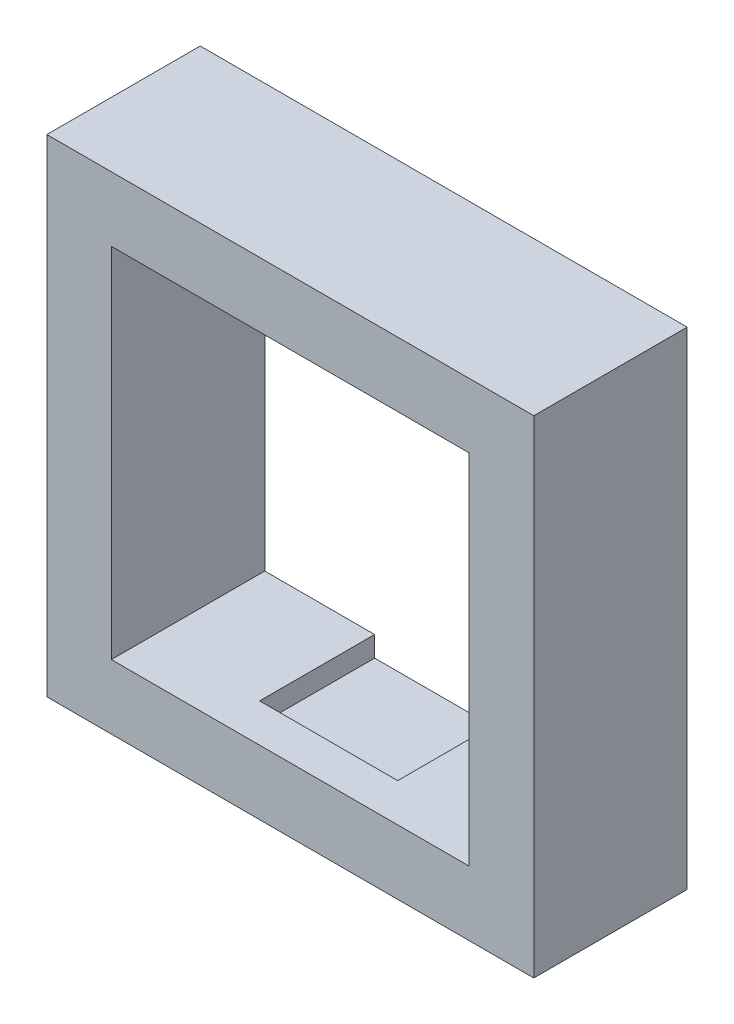
from build123d import *

# Parameters (mm, degrees)
SKETCH1_W           = 19.05
SKETCH1_H           = 19.05
SKETCH1_W_2         = 14
SKETCH1_H_2         = 14
BOSS_EXTRUDE1_DEPTH = 6
CUT_EXTRUDE1_START  = -0.8
SKETCH2_W           = 5.4
SKETCH2_H           = 4.5
CUT_EXTRUDE1_DEPTH  = 15.6


with BuildPart() as part:
    # Sketch1 → Boss-Extrude1 (new body)
    with BuildSketch(Plane.XY):
        Rectangle(SKETCH1_W, SKETCH1_H)
        Rectangle(SKETCH1_W_2, SKETCH1_H_2, mode=Mode.SUBTRACT)
    extrude(amount=BOSS_EXTRUDE1_DEPTH)

    # Sketch2 → Cut-Extrude1 (cut)
    with BuildSketch(Plane.XZ.offset(-7).offset(CUT_EXTRUDE1_START)):
        with Locations((0, 2.25)):
            Rectangle(SKETCH2_W, SKETCH2_H)
    extrude(amount=CUT_EXTRUDE1_DEPTH, mode=Mode.SUBTRACT)


solid = part.part
